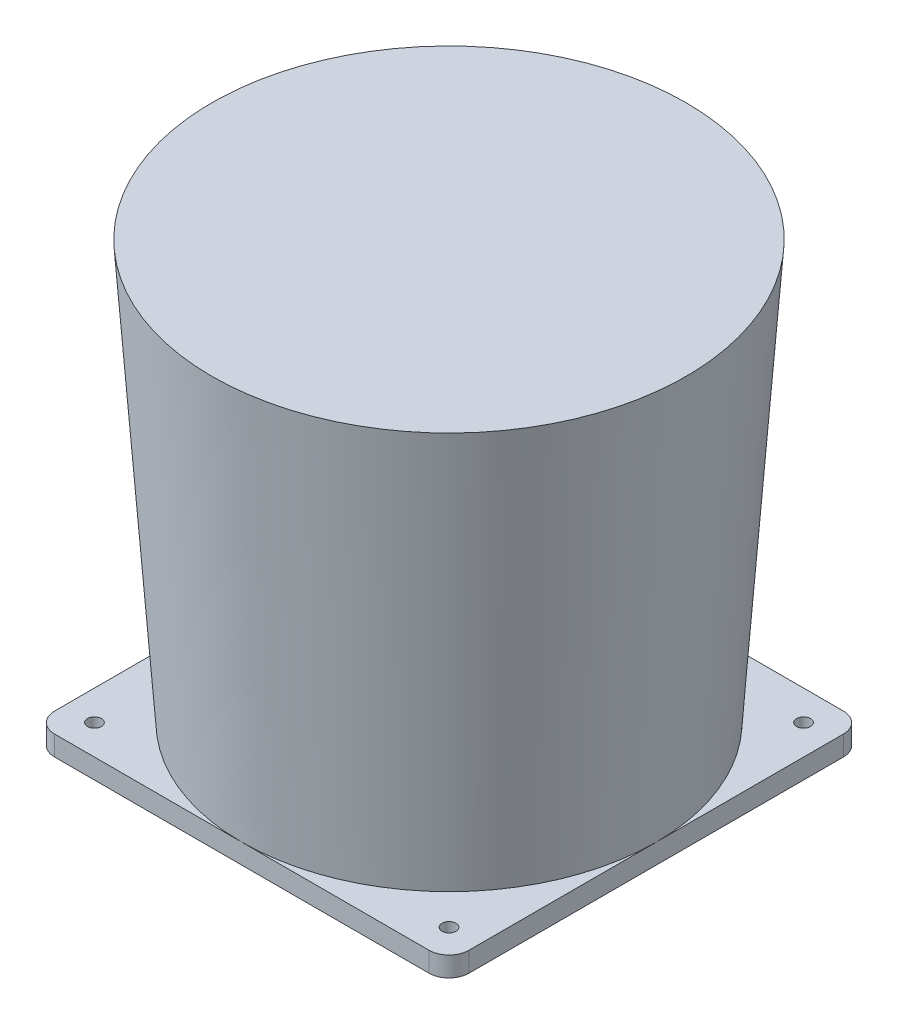
from build123d import *

# Parameters (mm, degrees)
SKETCH5_R           = 3.5
BOSS_EXTRUDE2_DEPTH = 10
SKETCH7_R           = 119
SKETCH6_R           = 104


with BuildPart() as part:
    # Sketch5 → Boss-Extrude2 (new body)
    with BuildSketch(Plane(origin=(0, 0, 0), x_dir=(1, 0, 0), z_dir=(0, 1, 0))):
        with BuildLine():
            Line((-94, 104), (94, 104))
            ThreePointArc((94, 104), (101.071067812, 101.071067812), (104, 94))
            Line((104, 94), (104, -94))
            ThreePointArc((104, -94), (101.071067812, -101.071067812), (94, -104))
            Line((94, -104), (-94, -104))
            ThreePointArc((-94, -104), (-101.071067812, -101.071067812), (-104, -94))
            Line((-104, -94), (-104, 94))
            ThreePointArc((-104, 94), (-101.071067812, 101.071067812), (-94, 104))
        make_face()
        with Locations(Location((-89, 89, 0), (0, 0, 270))):
            Circle(SKETCH5_R, mode=Mode.SUBTRACT)
        with Locations(Location((89, 89, 0), (0, 0, 270))):
            Circle(SKETCH5_R, mode=Mode.SUBTRACT)
        with Locations(Location((89, -89, 0), (0, 0, 270))):
            Circle(SKETCH5_R, mode=Mode.SUBTRACT)
        with Locations(Location((-89, -89, 0), (0, 0, 270))):
            Circle(SKETCH5_R, mode=Mode.SUBTRACT)
    extrude(amount=BOSS_EXTRUDE2_DEPTH)

    # Sketch7 → Loft3 section 0
    with BuildSketch(Plane(origin=(0, 220, 0), x_dir=(1, 0, 0), z_dir=(0, 1, 0))):
        Circle(SKETCH7_R)
    # Sketch6 → Loft3 section 1
    with BuildSketch(Plane(origin=(0, 10, 0), x_dir=(1, 0, 0), z_dir=(0, 1, 0))):
        Circle(SKETCH6_R)
    loft()


solid = part.part
